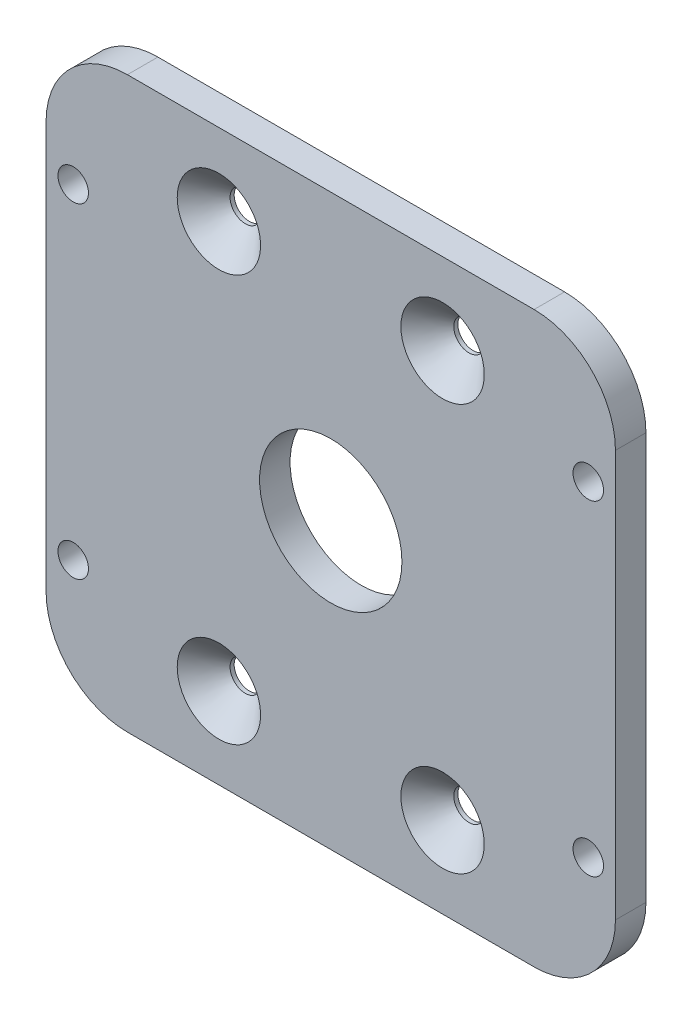
from build123d import *

# Parameters (mm, degrees)
EXTRUDE_1_DEPTH     = 3
SKETCH_2_R          = 7
CUT_EXTRUDE_1_DEPTH = 80.252760204
SKETCH_3_R          = 1.5
CUT_EXTRUDE_2_DEPTH = 80.252760204
SKETCH_4_R          = 1.5
CUT_EXTRUDE_3_DEPTH = 80.252760204
CHAMFER_1_SIZE      = 2.6


with BuildPart() as part:
    # Эскиз1 → Бобышка-Вытянуть1 (new body)
    with BuildSketch(Plane.XY):
        with BuildLine():
            Line((8, 0), (48, 0))
            ThreePointArc((48, 0), (53.656854249, 2.343145751), (56, 8))
            Line((56, 8), (56, 48))
            ThreePointArc((56, 48), (53.656854249, 53.656854249), (48, 56))
            Line((48, 56), (8, 56))
            ThreePointArc((8, 56), (2.343145751, 53.656854249), (0, 48))
            Line((0, 48), (0, 8))
            ThreePointArc((0, 8), (2.343145751, 2.343145751), (8, 0))
        make_face()
    extrude(amount=EXTRUDE_1_DEPTH)

    # Эскиз2 → Вырез-Вытянуть1 (cut, through all)
    with BuildSketch(Plane.XY.offset(3)):
        with Locations((28, 28)):
            Circle(SKETCH_2_R)
    extrude(amount=-CUT_EXTRUDE_1_DEPTH, mode=Mode.SUBTRACT)

    # Эскиз3 → Вырез-Вытянуть2 (cut, through all)
    with BuildSketch(Plane.XY.offset(3)):
        with Locations((2.67, 12)):
            Circle(SKETCH_3_R)
        with Locations((53.33, 12)):
            Circle(SKETCH_3_R)
        with Locations((53.33, 44)):
            Circle(SKETCH_3_R)
        with Locations((2.67, 44)):
            Circle(SKETCH_3_R)
    extrude(amount=-CUT_EXTRUDE_2_DEPTH, mode=Mode.SUBTRACT)

    # Эскиз4 → Вырез-Вытянуть3 (cut, through all)
    with BuildSketch(Plane.XY.offset(3)):
        with Locations((17, 8)):
            Circle(SKETCH_4_R)
        with Locations((39, 8)):
            Circle(SKETCH_4_R)
        with Locations((39, 48)):
            Circle(SKETCH_4_R)
        with Locations((17, 48)):
            Circle(SKETCH_4_R)
    extrude(amount=-CUT_EXTRUDE_3_DEPTH, mode=Mode.SUBTRACT)

    # Фаска1
    chamfer_1_edges = [part.edges().sort_by_distance(p)[0] for p in [
        (15.5, 48, 3),
        (37.5, 48, 3),
        (37.5, 8, 3),
        (15.5, 8, 3),
    ]]
    chamfer(chamfer_1_edges, length=CHAMFER_1_SIZE)


solid = part.part
